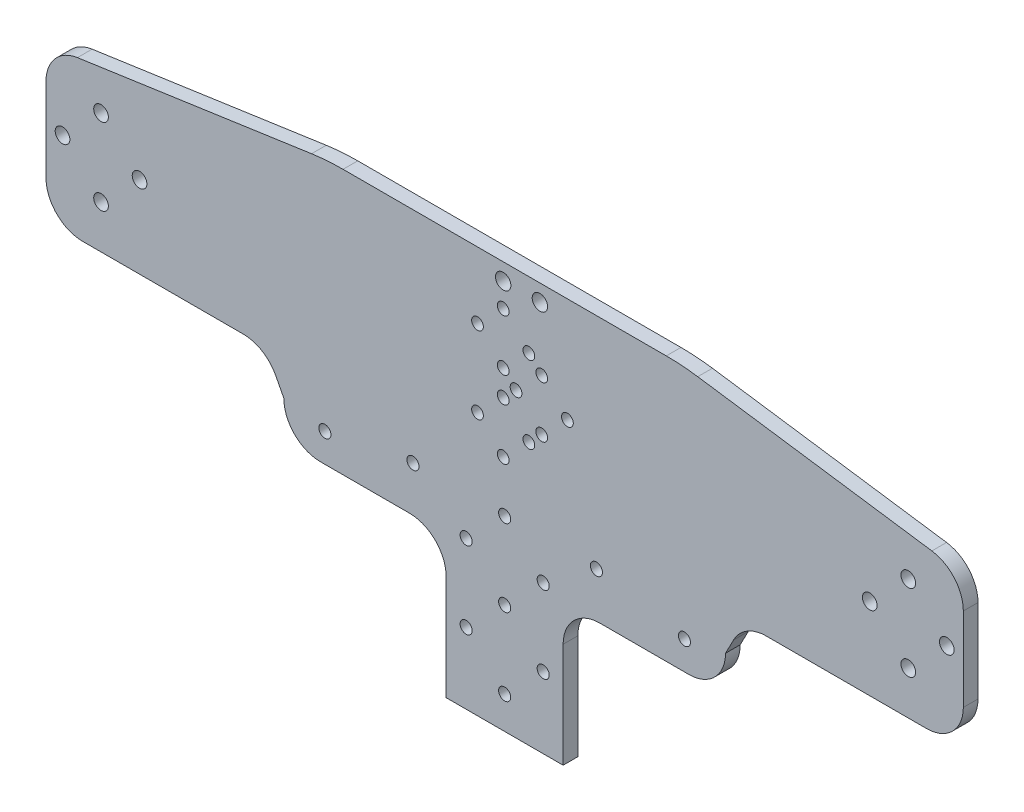
from build123d import *

# Parameters (mm, degrees)
SKETCH_1_R      = 1.65
SKETCH_1_R_2    = 2
SKETCH_1_R_3    = 1.6
SKETCH_1_R_4    = 2.1
EXTRUDE_1_DEPTH = 4


with BuildPart() as part:
    # 草图1 → 凸台-拉伸1 (new body)
    with BuildSketch(Plane.XY):
        with BuildLine():
            Line((-115, -5.384342662), (-71.257490086, -5.384342662))
            ThreePointArc((-71.257490086, -5.384342662), (-66.066099293, -6.837444884), (-62.383432799, -10.774450336))
            Line((-62.383432799, -10.774450336), (-60.183484139, -15.009358454))
            ThreePointArc((-60.183484139, -15.009358454), (-57.254551951, -22.080426266), (-50.183484139, -25.009358454))
            Line((-50.183484139, -25.009358454), (-25.933484139, -25.009358454))
            ThreePointArc((-25.933484139, -25.009358454), (-18.862416327, -27.938290642), (-15.933484139, -35.009358454))
            Line((-15.933484139, -35.009358454), (-15.933484139, -63.56099727))
            Line((-15.933484139, -63.56099727), (15.933484139, -63.56099727))
            Line((15.933484139, -63.56099727), (15.933484139, -35.009358454))
            ThreePointArc((15.933484139, -35.009358454), (18.862416327, -27.938290642), (25.933484139, -25.009358454))
            Line((25.933484139, -25.009358454), (50.183484139, -25.009358454))
            ThreePointArc((50.183484139, -25.009358454), (57.254551951, -22.080426266), (60.183484139, -15.009358454))
            Line((60.183484139, -15.009358454), (62.383432799, -10.774450336))
            ThreePointArc((62.383432799, -10.774450336), (66.066099293, -6.837444884), (71.257490086, -5.384342662))
            Line((71.257490086, -5.384342662), (115, -5.384342662))
            ThreePointArc((115, -5.384342662), (122.071067812, -2.455410474), (125, 4.615657338))
            Line((125, 4.615657338), (125, 27.373111507))
            ThreePointArc((125, 27.373111507), (122.559714668, 33.919157194), (116.429857174, 37.270359027))
            Line((116.429857174, 37.270359027), (52.621904203, 46.488705755))
            ThreePointArc((52.621904203, 46.488705755), (48.343394427, 46.950893444), (44.042761161, 47.105220638))
            Line((44.042761161, 47.105220638), (0.159946942, 47.105220638))
            Line((0.159946942, 47.105220638), (-0.159946942, 47.105220638))
            Line((-0.159946942, 47.105220638), (-44.042761161, 47.105220638))
            ThreePointArc((-44.042761161, 47.105220638), (-48.343394427, 46.950893444), (-52.621904203, 46.488705755))
            Line((-52.621904203, 46.488705755), (-116.429857174, 37.270359027))
            ThreePointArc((-116.429857174, 37.270359027), (-122.559714668, 33.919157194), (-125, 27.373111507))
            Line((-125, 27.373111507), (-125, 4.615657338))
            ThreePointArc((-125, 4.615657338), (-122.071067812, -2.455410474), (-115, -5.384342662))
        make_face()
        with Locations((0, -54.709358454)):
            Circle(SKETCH_1_R, mode=Mode.SUBTRACT)
        with Locations((-10.5, -44.209358454)):
            Circle(SKETCH_1_R, mode=Mode.SUBTRACT)
        with Locations((-10.5, -23.209358454)):
            Circle(SKETCH_1_R, mode=Mode.SUBTRACT)
        with Locations((-49, -17.209358454)):
            Circle(SKETCH_1_R, mode=Mode.SUBTRACT)
        with Locations((-25, -12.709358454)):
            Circle(SKETCH_1_R, mode=Mode.SUBTRACT)
        with Locations((10.5, -44.209358454)):
            Circle(SKETCH_1_R, mode=Mode.SUBTRACT)
        with Locations((0, -33.709358454)):
            Circle(SKETCH_1_R, mode=Mode.SUBTRACT)
        with Locations((10.5, -23.209358454)):
            Circle(SKETCH_1_R, mode=Mode.SUBTRACT)
        with Locations((0, -12.709358454)):
            Circle(SKETCH_1_R, mode=Mode.SUBTRACT)
        with Locations((25, -12.709358454)):
            Circle(SKETCH_1_R, mode=Mode.SUBTRACT)
        with Locations((49, -17.209358454)):
            Circle(SKETCH_1_R, mode=Mode.SUBTRACT)
        with Locations((-110, 6.402358032)):
            Circle(SKETCH_1_R_2, mode=Mode.SUBTRACT)
        with Locations((-120.5, 16.902358032)):
            Circle(SKETCH_1_R_2, mode=Mode.SUBTRACT)
        with Locations((-99.5, 16.902358032)):
            Circle(SKETCH_1_R_2, mode=Mode.SUBTRACT)
        with Locations((-0.4, 1.032228913)):
            Circle(SKETCH_1_R_3, mode=Mode.SUBTRACT)
        with Locations((-7.4, 8.032228913)):
            Circle(SKETCH_1_R_3, mode=Mode.SUBTRACT)
        with Locations((-0.4, 15.032228913)):
            Circle(SKETCH_1_R_3, mode=Mode.SUBTRACT)
        with Locations((-110, 27.402358032)):
            Circle(SKETCH_1_R_2, mode=Mode.SUBTRACT)
        with Locations((-0.4, 22.032228913)):
            Circle(SKETCH_1_R_3, mode=Mode.SUBTRACT)
        with Locations((-7.4, 29.032228913)):
            Circle(SKETCH_1_R_3, mode=Mode.SUBTRACT)
        with Locations((-0.4, 36.032228913)):
            Circle(SKETCH_1_R_3, mode=Mode.SUBTRACT)
        with Locations((-0.4, 42.532228913)):
            Circle(SKETCH_1_R_4, mode=Mode.SUBTRACT)
        with Locations((6.6, 8.032228913)):
            Circle(SKETCH_1_R_3, mode=Mode.SUBTRACT)
        with Locations((10.1, 11.532228913)):
            Circle(SKETCH_1_R_3, mode=Mode.SUBTRACT)
        with Locations((3.1, 18.532228913)):
            Circle(SKETCH_1_R_3, mode=Mode.SUBTRACT)
        with Locations((17.1, 18.532228913)):
            Circle(SKETCH_1_R_3, mode=Mode.SUBTRACT)
        with Locations((110, 6.402358032)):
            Circle(SKETCH_1_R_2, mode=Mode.SUBTRACT)
        with Locations((99.5, 16.902358032)):
            Circle(SKETCH_1_R_2, mode=Mode.SUBTRACT)
        with Locations((120.5, 16.902358032)):
            Circle(SKETCH_1_R_2, mode=Mode.SUBTRACT)
        with Locations((10.1, 25.532228913)):
            Circle(SKETCH_1_R_3, mode=Mode.SUBTRACT)
        with Locations((6.6, 29.032228913)):
            Circle(SKETCH_1_R_3, mode=Mode.SUBTRACT)
        with Locations((9.6, 42.532228913)):
            Circle(SKETCH_1_R_4, mode=Mode.SUBTRACT)
        with Locations((110, 27.402358032)):
            Circle(SKETCH_1_R_2, mode=Mode.SUBTRACT)
    extrude(amount=EXTRUDE_1_DEPTH)


solid = part.part
